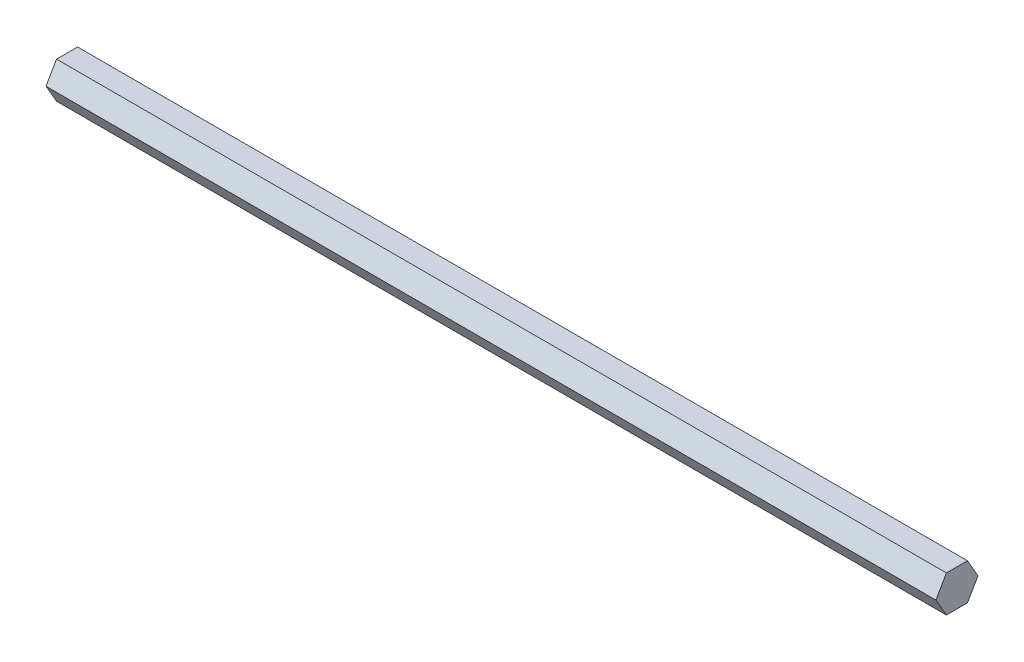
from build123d import *

# Parameters (mm, degrees)
SALIENTE_EXTRUIR1_DEPTH = 310


with BuildPart() as part:
    # Croquis1 → Saliente-Extruir1 (new body)
    with BuildSketch(Plane(origin=(0, 0, 0), x_dir=(0, 0, -1), z_dir=(1, 0, 0))):
        Polygon((7.332348419, 0), (3.666174209, 6.35), (-3.666174209, 6.35), (-7.332348419, 0), (-3.666174209, -6.35), (3.666174209, -6.35), align=None)
    extrude(amount=SALIENTE_EXTRUIR1_DEPTH)


solid = part.part
